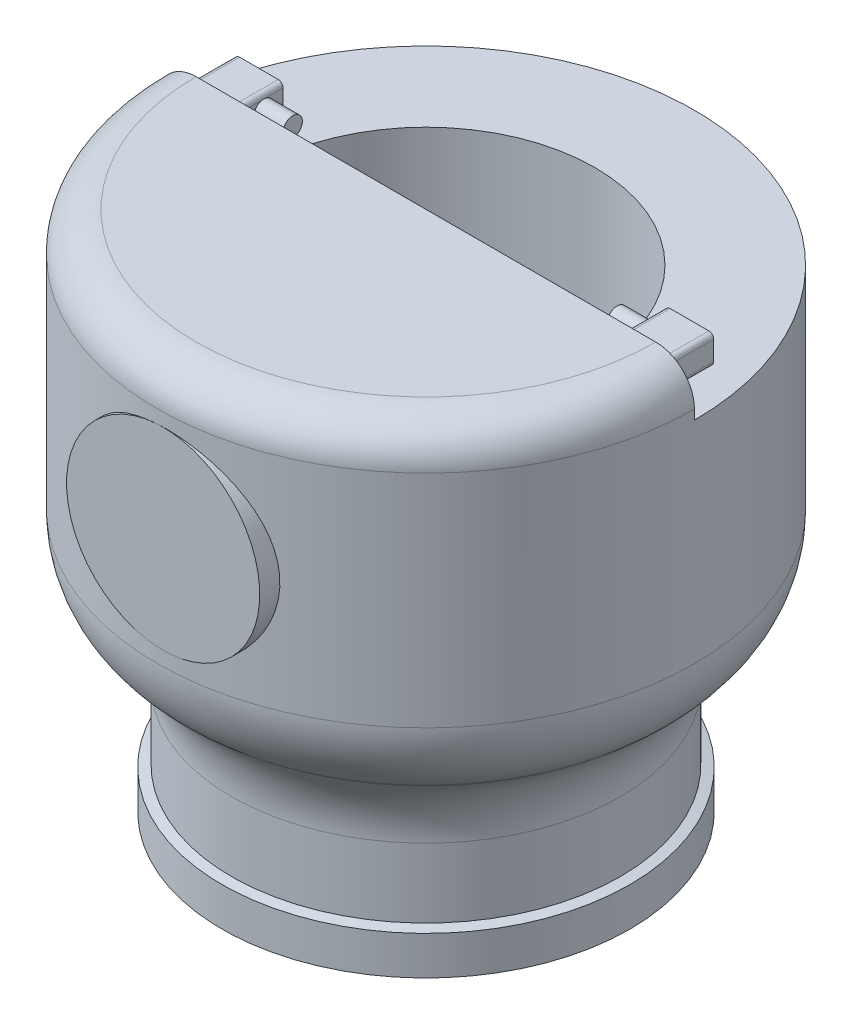
from build123d import *
from build123d.topology import SkipClean

# Parameters (mm, degrees)
SKETCH10_R              = 10
BOSS_EXTRUDE1_DEPTH     = 5
CUT_EXTRUDE3_DEPTH      = 45
CUT_EXTRUDE3_DEPTH_BACK = 20
CUT_EXTRUDE5_DEPTH      = 5
BOSS_EXTRUDE2_DEPTH     = 5
SKETCH14_R              = 1
BOSS_EXTRUDE3_DEPTH     = 3
SKETCH15_R              = 1
BOSS_EXTRUDE4_DEPTH     = 3


with BuildPart() as part:
    # Sketch1 → Revolve1 (revolve)
    with BuildSketch(Plane.XY):
        with BuildLine():
            Line((20.9, 0), (23.871591838, 0))
            Line((23.871591838, 0), (23.871591838, 4))
            Line((23.871591838, 4), (22.9, 4.236662843))
            Line((22.9, 4.236662843), (22.9, 11.404308102))
            ThreePointArc((22.9, 11.404308102), (23.83692213, 15.63049072), (26.472123903, 19.064752533))
            Line((26.472123903, 19.064752533), (26.988320528, 19.497892931))
            ThreePointArc((26.988320528, 19.497892931), (29.623522302, 22.932154745), (30.560444431, 27.158337362))
            Line((30.560444431, 27.158337362), (30.560444431, 50))
            ThreePointArc((30.560444431, 50), (29.388871556, 52.828427125), (26.560444431, 54))
            Line((26.560444431, 54), (2.764914955, 54))
            Line((2.764914955, 54), (2.764914955, 15))
            Line((2.764914955, 15), (19.9, 15))
            ThreePointArc((19.9, 15), (20.607106781, 14.707106781), (20.9, 14))
            Line((20.9, 14), (20.9, 0))
        make_face()
    revolve(axis=Axis((2.764914955, 7.821821657, 0), (0, 1, 0)))

    # Sketch10 → Boss-Extrude1 (add)
    with SkipClean():  # the faces are left unmerged after this step: merging them gives an invalid solid
        with BuildSketch(Plane.XY.offset(27.795529476)):
            with Locations((3.346345887, 38.658337362)):
                Circle(SKETCH10_R)
        extrude(amount=-BOSS_EXTRUDE1_DEPTH)

    # Sketch11 → Cut-Extrude3 (cut, two sides: drawn at the far end of the back side and taken through both)
    with SkipClean():  # the faces are left unmerged after this step: merging them gives an invalid solid
        with BuildSketch(Plane(origin=(0, 17, 0), x_dir=(1, 0, 0), z_dir=(0, 1, 0)).offset(-CUT_EXTRUDE3_DEPTH_BACK)):
            with BuildLine():
                Line((-14.735085045, 0), (20.264914955, 0))
                ThreePointArc((20.264914955, 0), (2.764914955, 17.5), (-14.735085045, 0))
            make_face()
        extrude(amount=CUT_EXTRUDE3_DEPTH + CUT_EXTRUDE3_DEPTH_BACK, mode=Mode.SUBTRACT)

    # Sketch9 → Cut-Extrude5 (cut)
    with SkipClean():  # the faces are left unmerged after this step: merging them gives an invalid solid
        with BuildSketch(Plane(origin=(0, 54, 0), x_dir=(1, 0, 0), z_dir=(0, 1, 0))):
            with BuildLine():
                Line((-25.235085045, 0), (30.764914955, 0))
                ThreePointArc((30.764914955, 0), (2.764914955, 28), (-25.235085045, 0))
            make_face()
        extrude(amount=-CUT_EXTRUDE5_DEPTH, mode=Mode.SUBTRACT)

    # Sketch13 → Boss-Extrude2 (add)
    with SkipClean():  # the faces are left unmerged after this step: merging them gives an invalid solid
        with BuildSketch(Plane(origin=(0, 0, 0), x_dir=(-1, 0, 0), z_dir=(0, 0, -1))):
            with BuildLine():
                Line((17.53061452, 53), (21.53061452, 53))
                ThreePointArc((21.53061452, 53), (21.884167911, 52.853553391), (22.03061452, 52.5))
                Line((22.03061452, 52.5), (22.03061452, 50.5))
                ThreePointArc((22.03061452, 50.5), (21.884167911, 50.146446609), (21.53061452, 50))
                Line((21.53061452, 50), (17.53061452, 50))
                ThreePointArc((17.53061452, 50), (17.17706113, 50.146446609), (17.03061452, 50.5))
                Line((17.03061452, 50.5), (17.03061452, 52.5))
                ThreePointArc((17.03061452, 52.5), (17.17706113, 52.853553391), (17.53061452, 53))
            make_face()
            with BuildLine():
                Line((-27.060444431, 52.75), (-23.060444431, 52.75))
                ThreePointArc((-23.060444431, 52.75), (-22.706891041, 52.603553391), (-22.560444431, 52.25))
                Line((-22.560444431, 52.25), (-22.560444431, 50.25))
                ThreePointArc((-22.560444431, 50.25), (-22.706891041, 49.896446609), (-23.060444431, 49.75))
                Line((-23.060444431, 49.75), (-27.060444431, 49.75))
                ThreePointArc((-27.060444431, 49.75), (-27.413997822, 49.896446609), (-27.560444431, 50.25))
                Line((-27.560444431, 50.25), (-27.560444431, 52.25))
                ThreePointArc((-27.560444431, 52.25), (-27.413997822, 52.603553391), (-27.060444431, 52.75))
            make_face()
        extrude(amount=BOSS_EXTRUDE2_DEPTH)

    # Sketch14 → Boss-Extrude3 (add)
    with SkipClean():  # the faces are left unmerged after this step: merging them gives an invalid solid
        with BuildSketch(Plane.ZY.offset(-22.560444431)):
            with Locations((-3, 51.25)):
                Circle(SKETCH14_R)
        extrude(amount=BOSS_EXTRUDE3_DEPTH)

    # Sketch15 → Boss-Extrude4 (add)
    with SkipClean():  # the faces are left unmerged after this step: merging them gives an invalid solid
        with BuildSketch(Plane(origin=(-17.03061452, 0, 0), x_dir=(0, 0, -1), z_dir=(1, 0, 0))):
            with Locations((3, 51.5)):
                Circle(SKETCH15_R)
        extrude(amount=BOSS_EXTRUDE4_DEPTH)


solid = part.part
